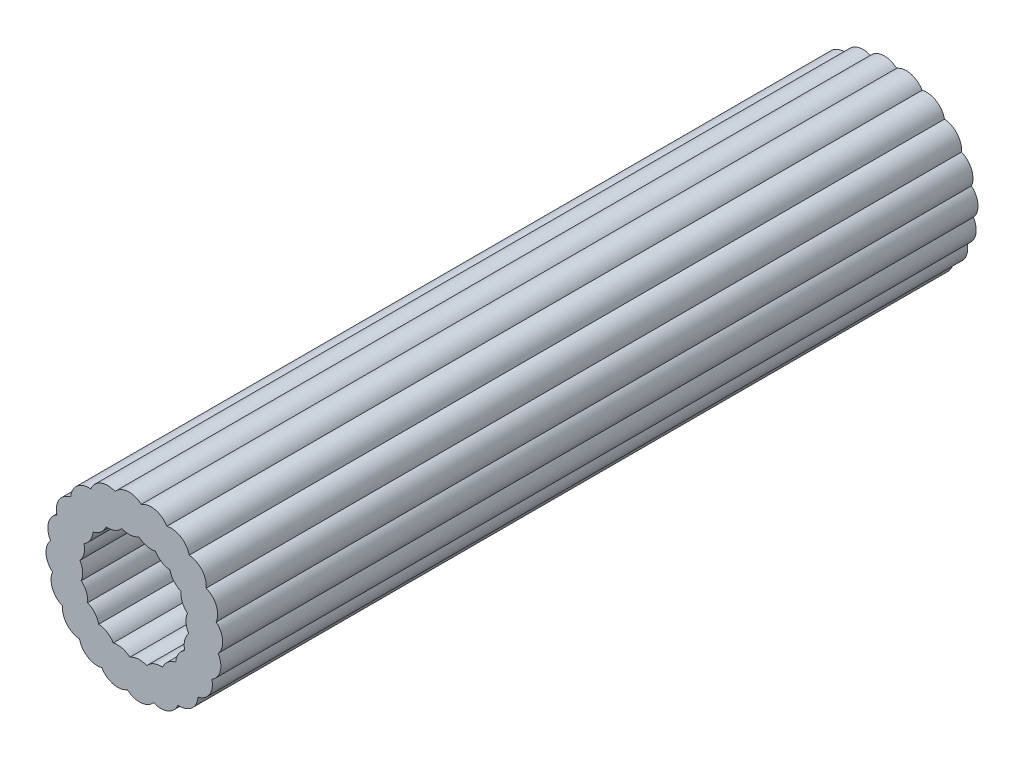
from build123d import *

# Parameters (mm, degrees)
EXTRUDE_1_DEPTH = 658.10320896


with BuildPart() as part:
    # 草图1 → 凸台-拉伸1 (new body)
    with BuildSketch(Plane.XY):
        with BuildLine():
            ThreePointArc((-16.784563495, 71.269141327), (-29.213900725, 71.400407716), (-37.986444329, 62.594265907))
            ThreePointArc((-37.986444329, 62.594265907), (-49.84801004, 58.878231228), (-55.469947326, 47.79222762))
            ThreePointArc((-55.469947326, 47.79222762), (-65.602648822, 40.592643239), (-67.523665397, 28.311953105))
            ThreePointArc((-67.523665397, 28.311953105), (-74.935643256, 18.333564505), (-72.967696633, 6.06030736))
            ThreePointArc((-72.967696633, 6.06030736), (-76.93341482, -5.720131261), (-71.269141327, -16.784563495))
            ThreePointArc((-71.269141327, -16.784563495), (-71.400407716, -29.213900725), (-62.594265907, -37.986444329))
            ThreePointArc((-62.594265907, -37.986444329), (-58.878231228, -49.84801004), (-47.79222762, -55.469947326))
            ThreePointArc((-47.79222762, -55.469947326), (-40.592643239, -65.602648822), (-28.311953105, -67.523665397))
            ThreePointArc((-28.311953105, -67.523665397), (-18.333564505, -74.935643256), (-6.06030736, -72.967696633))
            ThreePointArc((-6.06030736, -72.967696633), (5.720131261, -76.93341482), (16.784563495, -71.269141327))
            ThreePointArc((16.784563495, -71.269141327), (29.213900725, -71.400407716), (37.986444329, -62.594265907))
            ThreePointArc((37.986444329, -62.594265907), (49.84801004, -58.878231228), (55.469947326, -47.79222762))
            ThreePointArc((55.469947326, -47.79222762), (65.602648822, -40.592643239), (67.523665397, -28.311953105))
            ThreePointArc((67.523665397, -28.311953105), (74.935643256, -18.333564505), (72.967696633, -6.06030736))
            ThreePointArc((72.967696633, -6.06030736), (76.93341482, 5.720131261), (71.269141327, 16.784563495))
            ThreePointArc((71.269141327, 16.784563495), (71.400407716, 29.213900725), (62.594265907, 37.986444329))
            ThreePointArc((62.594265907, 37.986444329), (58.878231228, 49.84801004), (47.79222762, 55.469947326))
            ThreePointArc((47.79222762, 55.469947326), (40.592643239, 65.602648822), (28.311953105, 67.523665397))
            ThreePointArc((28.311953105, 67.523665397), (18.333564505, 74.935643256), (6.06030736, 72.967696633))
            ThreePointArc((6.06030736, 72.967696633), (-5.720131261, 76.93341482), (-16.784563495, 71.269141327))
        make_face()
        with BuildLine():
            ThreePointArc((-10.90414258, 46.300213814), (-3.3474183, 45.021400536), (3.937097057, 47.40368542))
            ThreePointArc((3.937097057, 47.40368542), (10.728793889, 43.852305495), (18.392946202, 43.866954016))
            ThreePointArc((18.392946202, 43.866954016), (23.754796981, 38.390641254), (31.048365622, 36.036219514))
            ThreePointArc((31.048365622, 36.036219514), (34.455515034, 29.171033565), (40.664554688, 24.678008767))
            ThreePointArc((40.664554688, 24.678008767), (41.783487211, 17.095961863), (46.300213814, 10.90414258))
            ThreePointArc((46.300213814, 10.90414258), (45.021400536, 3.3474183), (47.40368542, -3.937097057))
            ThreePointArc((47.40368542, -3.937097057), (43.852305495, -10.728793889), (43.866954016, -18.392946202))
            ThreePointArc((43.866954016, -18.392946202), (38.390641254, -23.754796981), (36.036219514, -31.048365622))
            ThreePointArc((36.036219514, -31.048365622), (29.171033565, -34.455515034), (24.678008767, -40.664554688))
            ThreePointArc((24.678008767, -40.664554688), (17.095961863, -41.783487211), (10.90414258, -46.300213814))
            ThreePointArc((10.90414258, -46.300213814), (3.3474183, -45.021400536), (-3.937097057, -47.40368542))
            ThreePointArc((-3.937097057, -47.40368542), (-10.728793889, -43.852305495), (-18.392946202, -43.866954016))
            ThreePointArc((-18.392946202, -43.866954016), (-23.754796981, -38.390641254), (-31.048365622, -36.036219514))
            ThreePointArc((-31.048365622, -36.036219514), (-34.455515034, -29.171033565), (-40.664554688, -24.678008767))
            ThreePointArc((-40.664554688, -24.678008767), (-41.783487211, -17.095961863), (-46.300213814, -10.90414258))
            ThreePointArc((-46.300213814, -10.90414258), (-45.021400536, -3.3474183), (-47.40368542, 3.937097057))
            ThreePointArc((-47.40368542, 3.937097057), (-43.852305495, 10.728793889), (-43.866954016, 18.392946202))
            ThreePointArc((-43.866954016, 18.392946202), (-38.390641254, 23.754796981), (-36.036219514, 31.048365622))
            ThreePointArc((-36.036219514, 31.048365622), (-29.171033565, 34.455515034), (-24.678008767, 40.664554688))
            ThreePointArc((-24.678008767, 40.664554688), (-17.095961863, 41.783487211), (-10.90414258, 46.300213814))
        make_face(mode=Mode.SUBTRACT)
    extrude(amount=EXTRUDE_1_DEPTH)


solid = part.part
